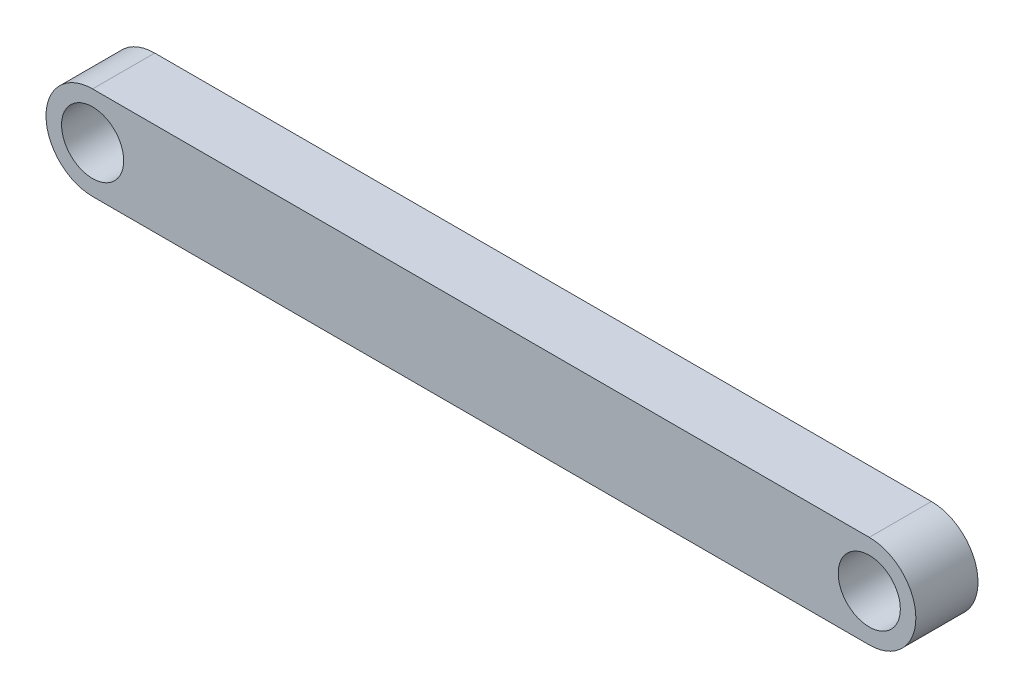
from build123d import *

# Parameters (mm, degrees)
SKETCH_1_R      = 10
EXTRUDE_1_DEPTH = 20


with BuildPart() as part:
    # Эскиз1 → Бобышка-Вытянуть1 (new body)
    with BuildSketch(Plane.XY):
        with BuildLine():
            Line((-75, -15), (-325, -15))
            ThreePointArc((-325, -15), (-340, 0), (-325, 15))
            Line((-325, 15), (-75, 15))
            ThreePointArc((-75, 15), (-60, 0), (-75, -15))
        make_face()
        with Locations((-75, 0)):
            Circle(SKETCH_1_R, mode=Mode.SUBTRACT)
        with Locations((-325, 0)):
            Circle(SKETCH_1_R, mode=Mode.SUBTRACT)
    extrude(amount=EXTRUDE_1_DEPTH)


solid = part.part
